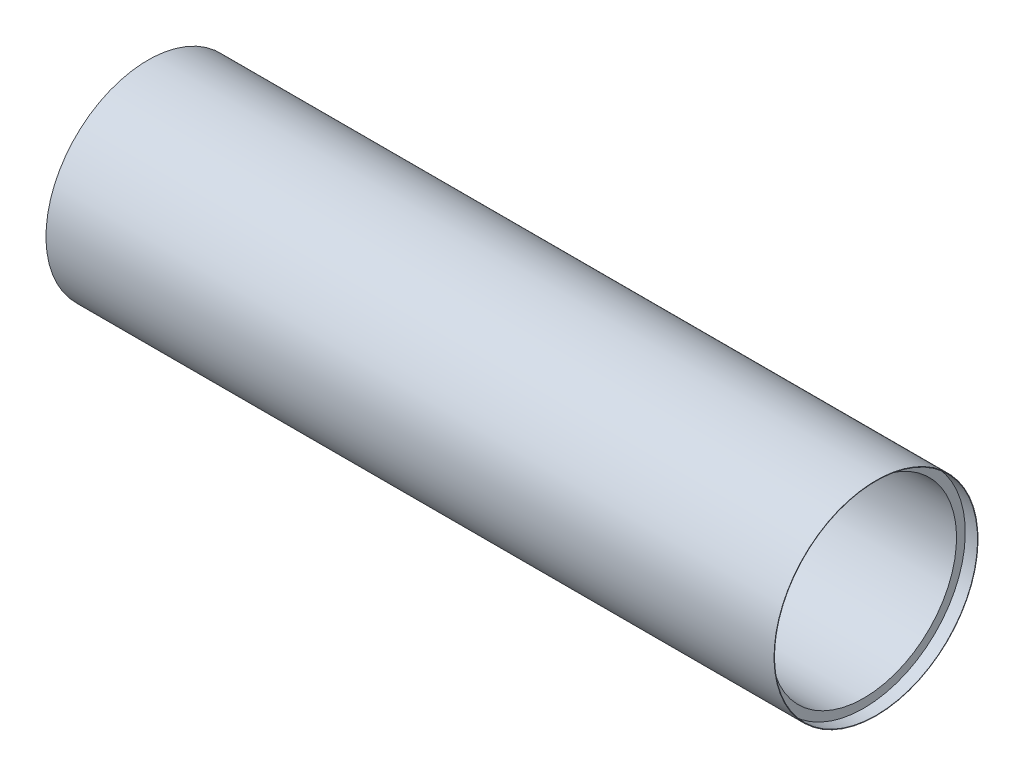
from build123d import *


with BuildPart() as part:
    # Sketch1 → Revolve1 (revolve)
    with BuildSketch(Plane.XY, mode=Mode.PRIVATE) as revolve1_sk:
        Polygon((39.146309032, 83.9724), (49.306309032, 83.9724), (49.306309032, 76.7334), (631.042509032, 76.7334), (631.042509032, 83.9724), (641.202509032, 83.9724), (641.202509032, 84.3534), (39.146309032, 84.3534), align=None)
    revolve(revolve1_sk.sketch.rotate(Axis((0, 0, 0), (1, 0, 0)), 180), axis=Axis((0, 0, 0), (1, 0, 0)))


solid = part.part
